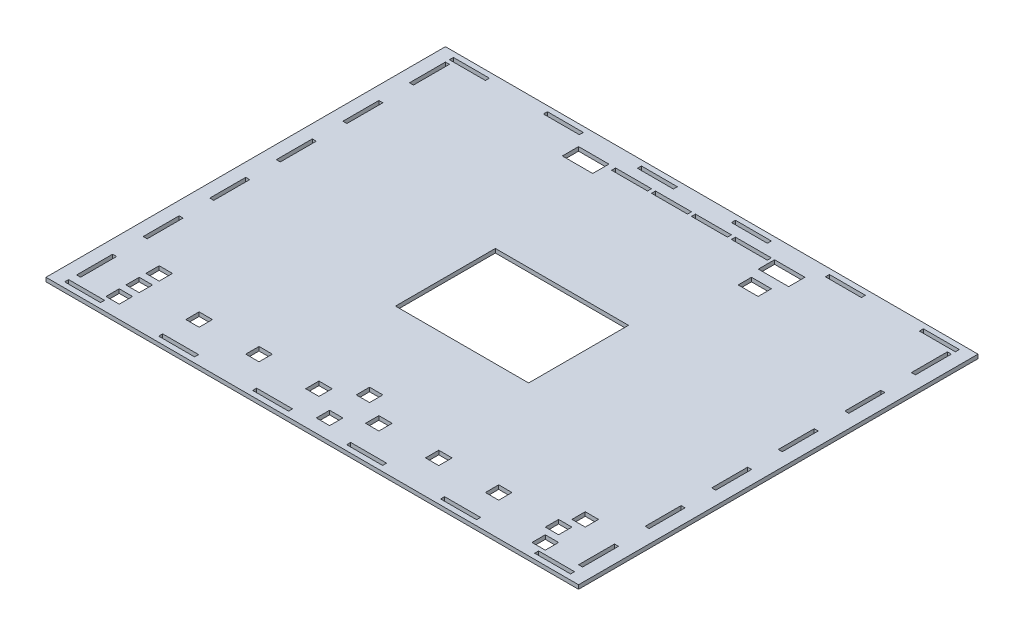
from build123d import *

# Parameters (mm, degrees)
SKETCH1_W           = 400
SKETCH1_H           = 300
SKETCH1_W_2         = 100
SKETCH1_H_2         = 75
BOSS_EXTRUDE2_DEPTH = 3
SKETCH2_W           = 10
SKETCH2_H           = 10
CUT_EXTRUDE1_DEPTH  = 3
SKETCH3_W           = 22.8
SKETCH3_H           = 12.2
CUT_EXTRUDE2_DEPTH  = 3
SKETCH4_W           = 15
SKETCH4_H           = 10
CUT_EXTRUDE3_DEPTH  = 3
SKETCH5_W           = 3
SKETCH5_H           = 27
CUT_EXTRUDE4_DEPTH  = 3
SKETCH6_W           = 3
SKETCH6_H           = 27
CUT_EXTRUDE5_DEPTH  = 3
SKETCH7_W           = 27
SKETCH7_H           = 3
CUT_EXTRUDE6_DEPTH  = 3
SKETCH8_W           = 10
SKETCH8_H           = 10
CUT_EXTRUDE7_DEPTH  = 3
SKETCH9_W           = 10
SKETCH9_H           = 10
CUT_EXTRUDE8_DEPTH  = 3
SKETCH11_W          = 10
SKETCH11_H          = 10
CUT_EXTRUDE9_DEPTH  = 3
SKETCH12_W          = 27
SKETCH12_H          = 3
CUT_EXTRUDE10_DEPTH = 10
SKETCH13_W          = 27
SKETCH13_H          = 3
CUT_EXTRUDE11_DEPTH = 10


with BuildPart() as part:
    # Sketch1 → Boss-Extrude2 (new body)
    with BuildSketch(Plane(origin=(0, 0, 0), x_dir=(1, 0, 0), z_dir=(0, 1, 0))):
        Rectangle(SKETCH1_W, SKETCH1_H)
        Rectangle(SKETCH1_W_2, SKETCH1_H_2, mode=Mode.SUBTRACT)
    extrude(amount=BOSS_EXTRUDE2_DEPTH)

    # Sketch2 → Cut-Extrude1 (cut)
    with BuildSketch(Plane(origin=(0, 3, 0), x_dir=(1, 0, 0), z_dir=(0, 1, 0))):
        with Locations((-160, -120)):
            Rectangle(SKETCH2_W, SKETCH2_H)
        with Locations((-115, -120)):
            Rectangle(SKETCH2_W, SKETCH2_H)
        with Locations((-70, -120)):
            Rectangle(SKETCH2_W, SKETCH2_H)
        with Locations((-25, -120)):
            Rectangle(SKETCH2_W, SKETCH2_H)
        with Locations((20, -120)):
            Rectangle(SKETCH2_W, SKETCH2_H)
        with Locations((65, -120)):
            Rectangle(SKETCH2_W, SKETCH2_H)
        with Locations((110, -120)):
            Rectangle(SKETCH2_W, SKETCH2_H)
        with Locations((155, -120)):
            Rectangle(SKETCH2_W, SKETCH2_H)
    extrude(amount=-CUT_EXTRUDE1_DEPTH, mode=Mode.SUBTRACT)

    # Sketch3 → Cut-Extrude2 (cut)
    with BuildSketch(Plane(origin=(0, 3, 0), x_dir=(1, 0, 0), z_dir=(0, 1, 0))):
        with Locations((-73.6, 128.9)):
            Rectangle(SKETCH3_W, SKETCH3_H)
        with Locations((73.6, 128.9)):
            Rectangle(SKETCH3_W, SKETCH3_H)
    extrude(amount=-CUT_EXTRUDE2_DEPTH, mode=Mode.SUBTRACT)

    # Sketch4 → Cut-Extrude3 (cut)
    with BuildSketch(Plane(origin=(0, 3, 0), x_dir=(1, 0, 0), z_dir=(0, 1, 0))):
        with Locations((72.41501841, 109.945064446)):
            Rectangle(SKETCH4_W, SKETCH4_H)
    extrude(amount=-CUT_EXTRUDE3_DEPTH, mode=Mode.SUBTRACT)

    # Sketch5 → Cut-Extrude4 (cut)
    with BuildSketch(Plane(origin=(0, 3, 0), x_dir=(1, 0, 0), z_dir=(0, 1, 0))):
        with Locations((-188.5, 126.5)):
            Rectangle(SKETCH5_W, SKETCH5_H)
        with Locations((-188.5, 76.5)):
            Rectangle(SKETCH5_W, SKETCH5_H)
        with Locations((-188.5, 26.5)):
            Rectangle(SKETCH5_W, SKETCH5_H)
        with Locations((-188.5, -23.5)):
            Rectangle(SKETCH5_W, SKETCH5_H)
        with Locations((-188.5, -73.5)):
            Rectangle(SKETCH5_W, SKETCH5_H)
        with Locations((-188.5, -123.5)):
            Rectangle(SKETCH5_W, SKETCH5_H)
    extrude(amount=-CUT_EXTRUDE4_DEPTH, mode=Mode.SUBTRACT)

    # Sketch6 → Cut-Extrude5 (cut)
    with BuildSketch(Plane(origin=(0, 3, 0), x_dir=(1, 0, 0), z_dir=(0, 1, 0))):
        with Locations((188.5, 126.5)):
            Rectangle(SKETCH6_W, SKETCH6_H)
        with Locations((188.5, 76.5)):
            Rectangle(SKETCH6_W, SKETCH6_H)
        with Locations((188.5, 26.5)):
            Rectangle(SKETCH6_W, SKETCH6_H)
        with Locations((188.5, -23.5)):
            Rectangle(SKETCH6_W, SKETCH6_H)
        with Locations((188.5, -73.5)):
            Rectangle(SKETCH6_W, SKETCH6_H)
        with Locations((188.5, -123.5)):
            Rectangle(SKETCH6_W, SKETCH6_H)
    extrude(amount=-CUT_EXTRUDE5_DEPTH, mode=Mode.SUBTRACT)

    # Sketch7 → Cut-Extrude6 (cut)
    with BuildSketch(Plane(origin=(0, 3, 0), x_dir=(1, 0, 0), z_dir=(0, 1, 0))):
        with Locations((-43.7, 133.5)):
            Rectangle(SKETCH7_W, SKETCH7_H)
        with Locations((-13.7, 133.5)):
            Rectangle(SKETCH7_W, SKETCH7_H)
        with Locations((16.3, 133.5)):
            Rectangle(SKETCH7_W, SKETCH7_H)
        with Locations((46.3, 133.5)):
            Rectangle(SKETCH7_W, SKETCH7_H)
    extrude(amount=-CUT_EXTRUDE6_DEPTH, mode=Mode.SUBTRACT)

    # Sketch8 → Cut-Extrude7 (cut)
    with BuildSketch(Plane(origin=(0, 3, 0), x_dir=(1, 0, 0), z_dir=(0, 1, 0))):
        with Locations((-160, -135)):
            Rectangle(SKETCH8_W, SKETCH8_H)
        with Locations((-160, -105)):
            Rectangle(SKETCH8_W, SKETCH8_H)
    extrude(amount=-CUT_EXTRUDE7_DEPTH, mode=Mode.SUBTRACT)

    # Sketch9 → Cut-Extrude8 (cut)
    with BuildSketch(Plane(origin=(0, 3, 0), x_dir=(1, 0, 0), z_dir=(0, 1, 0))):
        with Locations((-2, -135)):
            Rectangle(SKETCH9_W, SKETCH9_H)
        with Locations((-2, -105)):
            Rectangle(SKETCH9_W, SKETCH9_H)
    extrude(amount=-CUT_EXTRUDE8_DEPTH, mode=Mode.SUBTRACT)

    # Sketch11 → Cut-Extrude9 (cut)
    with BuildSketch(Plane(origin=(0, 3, 0), x_dir=(1, 0, 0), z_dir=(0, 1, 0))):
        with Locations((160, -135)):
            Rectangle(SKETCH11_W, SKETCH11_H)
        with Locations((160, -105)):
            Rectangle(SKETCH11_W, SKETCH11_H)
    extrude(amount=-CUT_EXTRUDE9_DEPTH, mode=Mode.SUBTRACT)

    # Sketch12 → Cut-Extrude10 (cut)
    with BuildSketch(Plane.XZ):
        with Locations((-176.5, -144.5)):
            Rectangle(SKETCH12_W, SKETCH12_H)
        with Locations((-105.9, -144.5)):
            Rectangle(SKETCH12_W, SKETCH12_H)
        with Locations((-35.3, -144.5)):
            Rectangle(SKETCH12_W, SKETCH12_H)
        with Locations((35.3, -144.5)):
            Rectangle(SKETCH12_W, SKETCH12_H)
        with Locations((105.9, -144.5)):
            Rectangle(SKETCH12_W, SKETCH12_H)
        with Locations((176.5, -144.5)):
            Rectangle(SKETCH12_W, SKETCH12_H)
    extrude(amount=-CUT_EXTRUDE10_DEPTH, mode=Mode.SUBTRACT)

    # Sketch13 → Cut-Extrude11 (cut)
    with BuildSketch(Plane(origin=(0, 0, 0), x_dir=(-1, 0, 0), z_dir=(0, -1, 0))):
        with Locations((176.5, -144.5)):
            Rectangle(SKETCH13_W, SKETCH13_H)
        with Locations((105.9, -144.5)):
            Rectangle(SKETCH13_W, SKETCH13_H)
        with Locations((35.3, -144.5)):
            Rectangle(SKETCH13_W, SKETCH13_H)
        with Locations((-35.3, -144.5)):
            Rectangle(SKETCH13_W, SKETCH13_H)
        with Locations((-105.9, -144.5)):
            Rectangle(SKETCH13_W, SKETCH13_H)
        with Locations((-176.5, -144.5)):
            Rectangle(SKETCH13_W, SKETCH13_H)
    extrude(amount=-CUT_EXTRUDE11_DEPTH, mode=Mode.SUBTRACT)


solid = part.part
